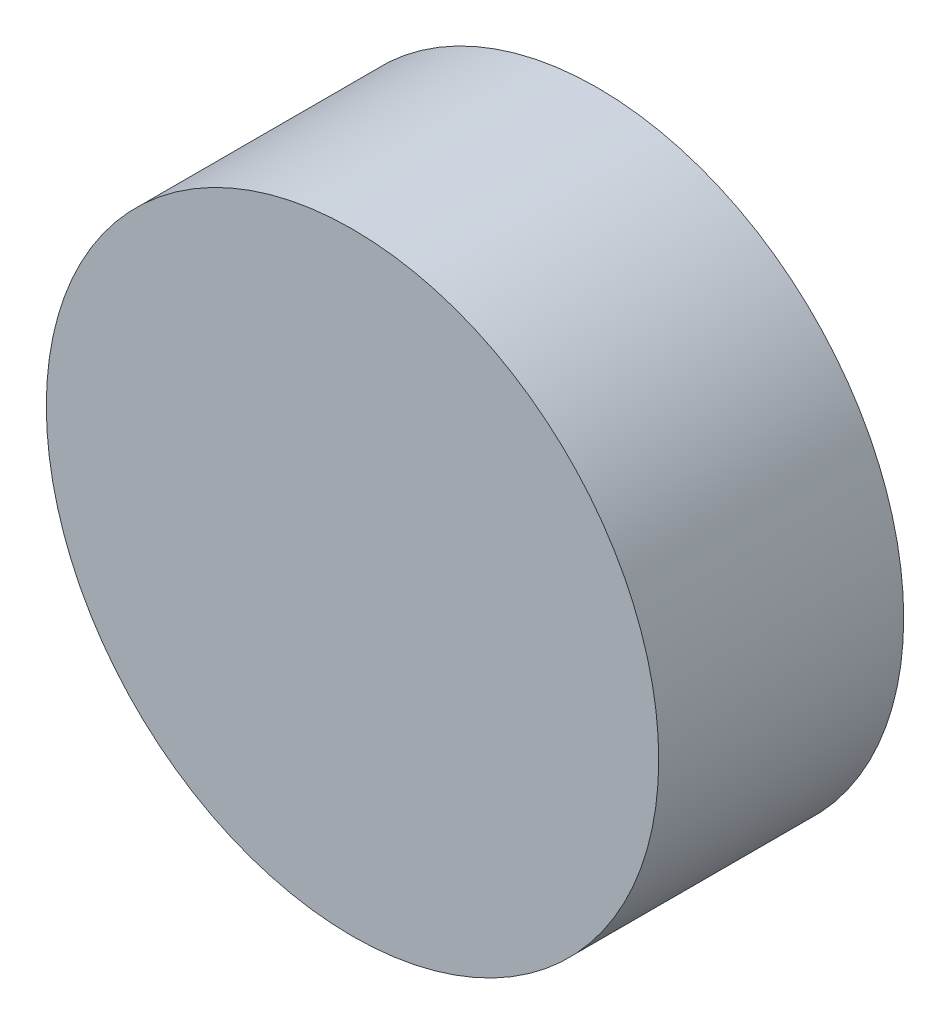
from build123d import *


with BuildPart() as part:
    # Sketch1 → Revolve1 (revolve)
    with BuildSketch(Plane(origin=(0, 0, 0), x_dir=(1, 0, 0), z_dir=(0, 1, 0))):
        Polygon((-25, -20), (0, -20), (0, -10), (-15, -10), (-15, 0), (-25, 0), align=None)
    revolve(axis=Axis((0, 0, 0), (0, 0, 1)))


solid = part.part
